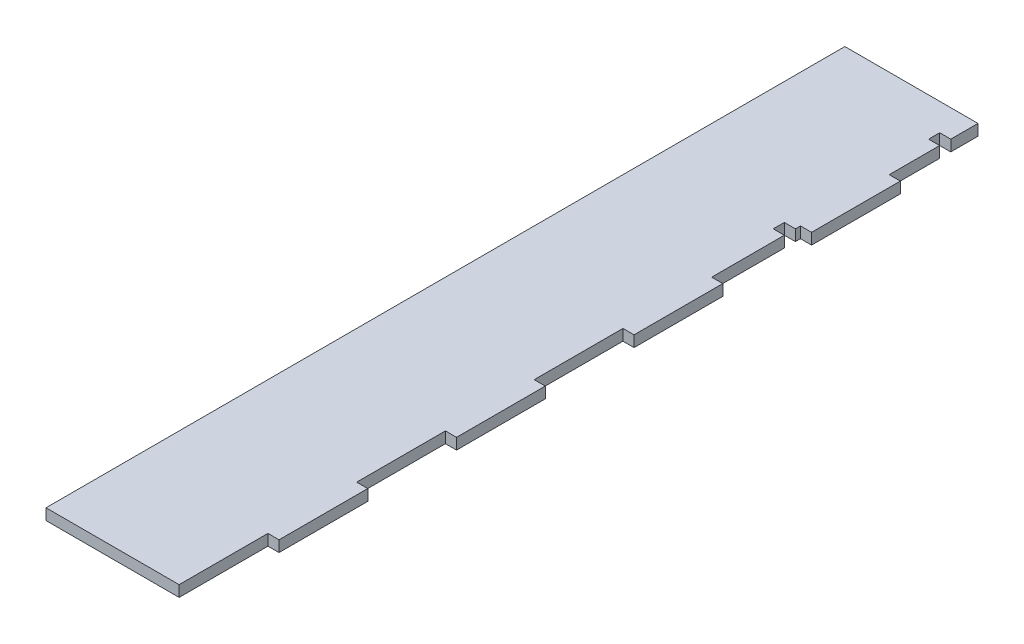
from build123d import *

# Parameters (mm, degrees)
SKETCH1_W           = 76.2
SKETCH1_H           = 6.35
BOSS_EXTRUDE1_DEPTH = 457.2
SKETCH2_W           = 50.8
SKETCH2_H           = 6.35
BOSS_EXTRUDE2_DEPTH = 6.35
SKETCH3_W           = 6.35
SKETCH3_H           = 6.35
CUT_EXTRUDE1_DEPTH  = 6.35
SKETCH4_W           = 6.35
SKETCH4_H           = 6.35
CUT_EXTRUDE2_DEPTH  = 460.399570091


with BuildPart() as part:
    # Sketch1 → Boss-Extrude1 (new body)
    with BuildSketch(Plane.XY):
        with Locations((0, -41.275)):
            Rectangle(SKETCH1_W, SKETCH1_H)
    extrude(amount=BOSS_EXTRUDE1_DEPTH)

    # Sketch2 → Boss-Extrude2 (add)
    with BuildSketch(Plane(origin=(38.1, 0, 0), x_dir=(0, 0, -1), z_dir=(1, 0, 0))):
        with Locations((-381, -41.275)):
            Rectangle(SKETCH2_W, SKETCH2_H)
        with Locations((-279.4, -41.275)):
            Rectangle(SKETCH2_W, SKETCH2_H)
        with Locations((-177.8, -41.275)):
            Rectangle(SKETCH2_W, SKETCH2_H)
        with Locations((-76.2, -41.275)):
            Rectangle(SKETCH2_W, SKETCH2_H)
    extrude(amount=BOSS_EXTRUDE2_DEPTH)

    # Sketch3 → Cut-Extrude1 (cut)
    with BuildSketch(Plane(origin=(0, -38.1, 0), x_dir=(1, 0, 0), z_dir=(0, 1, 0))):
        with Locations((34.925, -107.6625)):
            Rectangle(SKETCH3_W, SKETCH3_H)
    extrude(amount=-CUT_EXTRUDE1_DEPTH, mode=Mode.SUBTRACT)

    # Sketch4 → Cut-Extrude2 (cut, through all)
    with BuildSketch(Plane(origin=(0, -38.1, 0), x_dir=(1, 0, 0), z_dir=(0, 1, 0))):
        with Locations((34.925, -18.7625)):
            Rectangle(SKETCH4_W, SKETCH4_H)
    extrude(amount=-CUT_EXTRUDE2_DEPTH, mode=Mode.SUBTRACT)


solid = part.part
